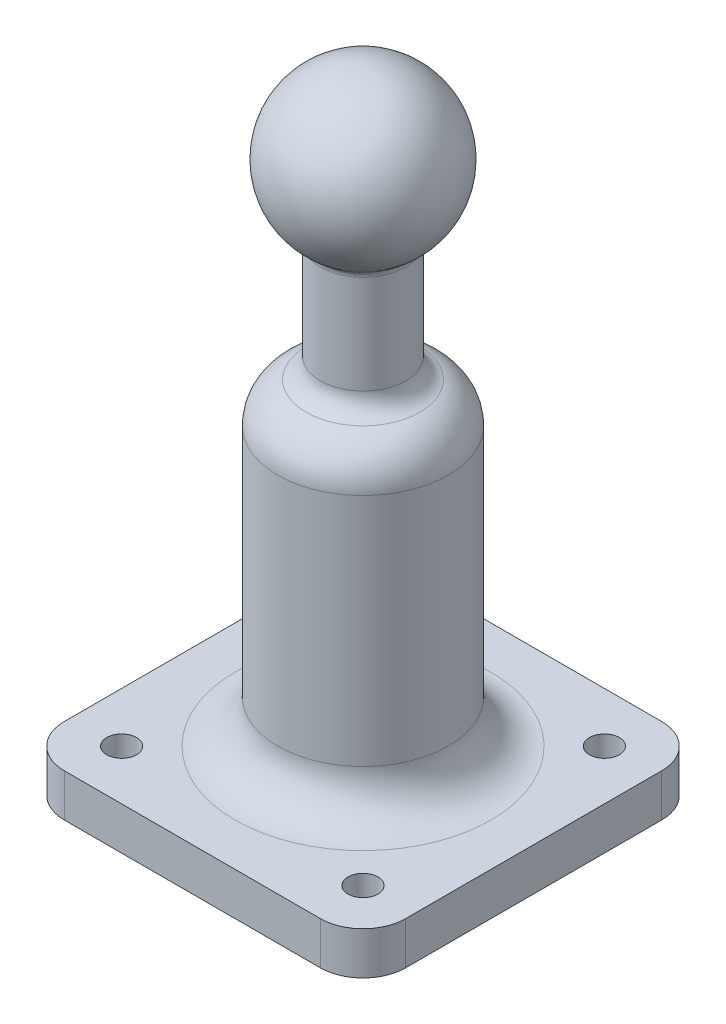
from build123d import *

# Parameters (mm, degrees)
SKETCH1_R           = 3.5
BOSS_EXTRUDE1_DEPTH = 10
SKETCH2_R           = 20
BOSS_EXTRUDE2_DEPTH = 75
FILLET1_R           = 10
SKETCH3_R           = 10
BOSS_EXTRUDE3_DEPTH = 30
FILLET2_R           = 5
FILLET3_R           = 2


with BuildPart() as part:
    # Sketch1 → Boss-Extrude1 (new body)
    with BuildSketch(Plane(origin=(0, 0, 0), x_dir=(1, 0, 0), z_dir=(0, 1, 0))):
        with BuildLine():
            Line((-30, 40), (30, 40))
            ThreePointArc((30, 40), (37.071067812, 37.071067812), (40, 30))
            Line((40, 30), (40, -30))
            ThreePointArc((40, -30), (37.071067812, -37.071067812), (30, -40))
            Line((30, -40), (-30, -40))
            ThreePointArc((-30, -40), (-37.071067812, -37.071067812), (-40, -30))
            Line((-40, -30), (-40, 30))
            ThreePointArc((-40, 30), (-37.071067812, 37.071067812), (-30, 40))
        make_face()
        with Locations(Location((-28.284271247, 28.284271247, 0), (0, 0, 270))):
            Circle(SKETCH1_R, mode=Mode.SUBTRACT)
        with Locations(Location((28.284271247, 28.284271247, 0), (0, 0, 270))):
            Circle(SKETCH1_R, mode=Mode.SUBTRACT)
        with Locations(Location((28.284271247, -28.284271247, 0), (0, 0, 270))):
            Circle(SKETCH1_R, mode=Mode.SUBTRACT)
        with Locations(Location((-28.284271247, -28.284271247, 0), (0, 0, 270))):
            Circle(SKETCH1_R, mode=Mode.SUBTRACT)
    extrude(amount=BOSS_EXTRUDE1_DEPTH)

    # Sketch2 → Boss-Extrude2 (add)
    with BuildSketch(Plane(origin=(0, 10, 0), x_dir=(1, 0, 0), z_dir=(0, 1, 0))):
        with Locations(Location((0, 0, 0), (0, 0, 270))):
            Circle(SKETCH2_R)
    extrude(amount=BOSS_EXTRUDE2_DEPTH)

    # Fillet1
    fillet1_edges = [part.edges().sort_by_distance(p)[0] for p in [
        (0, 10, -20),
        (0, 85, -20),
    ]]
    fillet(fillet1_edges, radius=FILLET1_R)

    # Sketch3 → Boss-Extrude3 (add)
    with BuildSketch(Plane(origin=(0, 85, 0), x_dir=(1, 0, 0), z_dir=(0, 1, 0))):
        with Locations(Location((0, 0, 0), (0, 0, 270))):
            Circle(SKETCH3_R)
    extrude(amount=BOSS_EXTRUDE3_DEPTH)

    # Fillet2
    fillet2_edges = [part.edges().sort_by_distance(p)[0] for p in [
        (0, 85, -10),
    ]]
    fillet(fillet2_edges, radius=FILLET2_R)

    # Sketch4 → Revolve1 (revolve)
    with BuildSketch(Plane.XY):
        with BuildLine():
            Line((0, 110.392135624), (0, 147.892135624))
            ThreePointArc((0, 147.892135624), (18.75, 129.142135624), (0, 110.392135624))
        make_face()
    revolve(axis=Axis((0, 115, 0), (0, 1, 0)))

    # Fillet3
    fillet3_edges = [part.edges().sort_by_distance(p)[0] for p in [
        (-7.071067812, 113.281413698, -7.071067812),
    ]]
    fillet(fillet3_edges, radius=FILLET3_R)


solid = part.part
